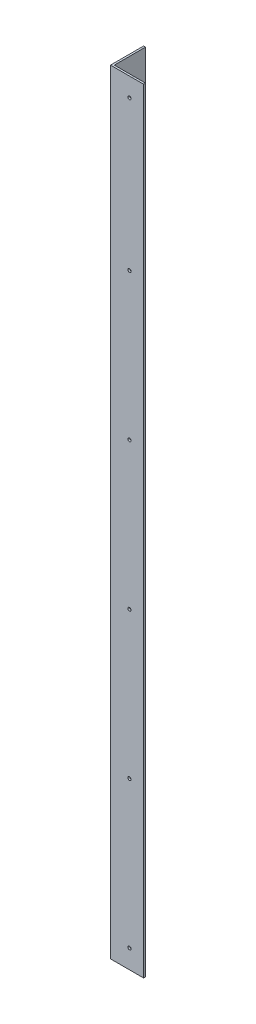
from build123d import *

# Parameters (mm, degrees)
ESTRUSIONE_ESTRUSIONE1_DEPTH = 819
SCHIZZO3_R                   = 1.7
TAGLIO_ESTRUSIONE1_DEPTH     = 821.494363174


with BuildPart() as part:
    # Schizzo2 → Estrusione-Estrusione1 (new body)
    with BuildSketch(Plane(origin=(0, 0, 0), x_dir=(1, 0, 0), z_dir=(0, 1, 0))):
        Polygon((0, 0), (35, 0), (35, 2), (2, 2), (2, 35), (0, 35), align=None)
    extrude(amount=ESTRUSIONE_ESTRUSIONE1_DEPTH)

    # Schizzo3 → Taglio-Estrusione1 (cut, through all)
    with BuildSketch(Plane.XY):
        with Locations((20, 20)):
            Circle(SCHIZZO3_R)
        with Locations((20, 330.4)):
            Circle(SCHIZZO3_R)
        with Locations((20, 485.6)):
            Circle(SCHIZZO3_R)
        with Locations((20, 175.2)):
            Circle(SCHIZZO3_R)
        with Locations((20, 640.8)):
            Circle(SCHIZZO3_R)
        with Locations((20, 799)):
            Circle(SCHIZZO3_R)
    extrude(amount=-TAGLIO_ESTRUSIONE1_DEPTH, mode=Mode.SUBTRACT)


solid = part.part
